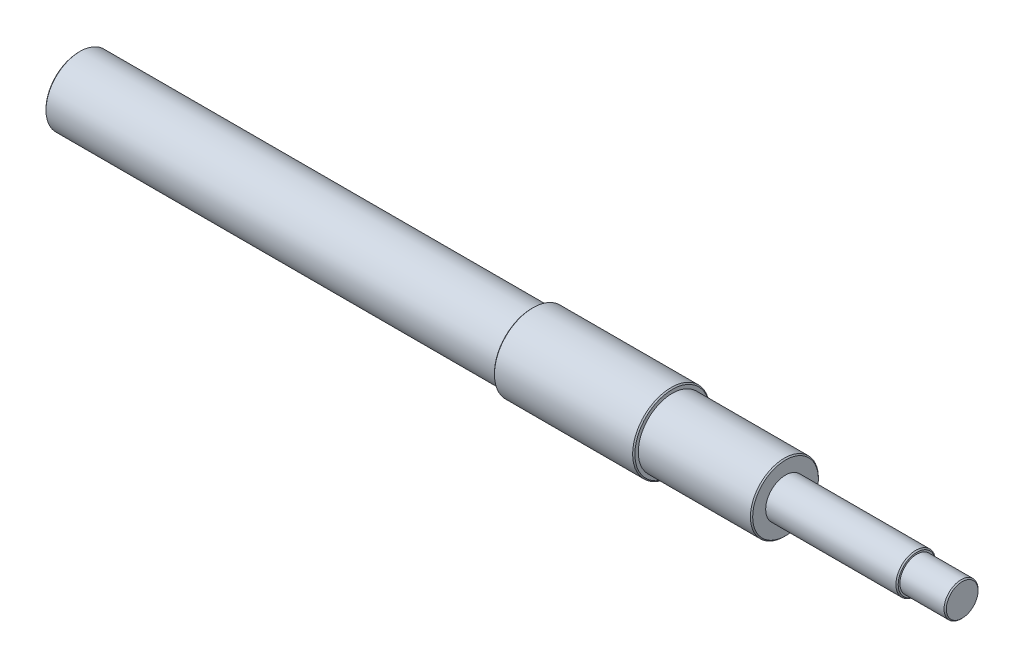
from build123d import *

# Parameters (mm, degrees)
CHAMFER1_SIZE = 0.1


with BuildPart() as part:
    # Sketch1 → Revolve1 (revolve)
    with BuildSketch(Plane.XY, mode=Mode.PRIVATE) as revolve1_sk:
        Polygon((-25.6, 3), (-15.6, 3), (-15.6, 1.75), (-4, 1.75), (-4, 1.5), (0, 1.5), (0, 0), (-78, 0), (-78, 3), (-38, 3), (-38, 3.4), (-25.6, 3.4), align=None)
    revolve(revolve1_sk.sketch.rotate(Axis((0, 0, 0), (1, 0, 0)), 90), axis=Axis((0, 0, 0), (1, 0, 0)))

    # Chamfer1
    chamfer1_edges = [part.edges().sort_by_distance(p)[0] for p in [
        (-4, 0, -1.75),
        (-15.6, 0, -3),
        (-25.6, 0, -3.4),
        (-38, 0, -3.4),
        (-78, 0, -3),
        (0, 0, -1.5),
    ]]
    chamfer(chamfer1_edges, length=CHAMFER1_SIZE)


solid = part.part
